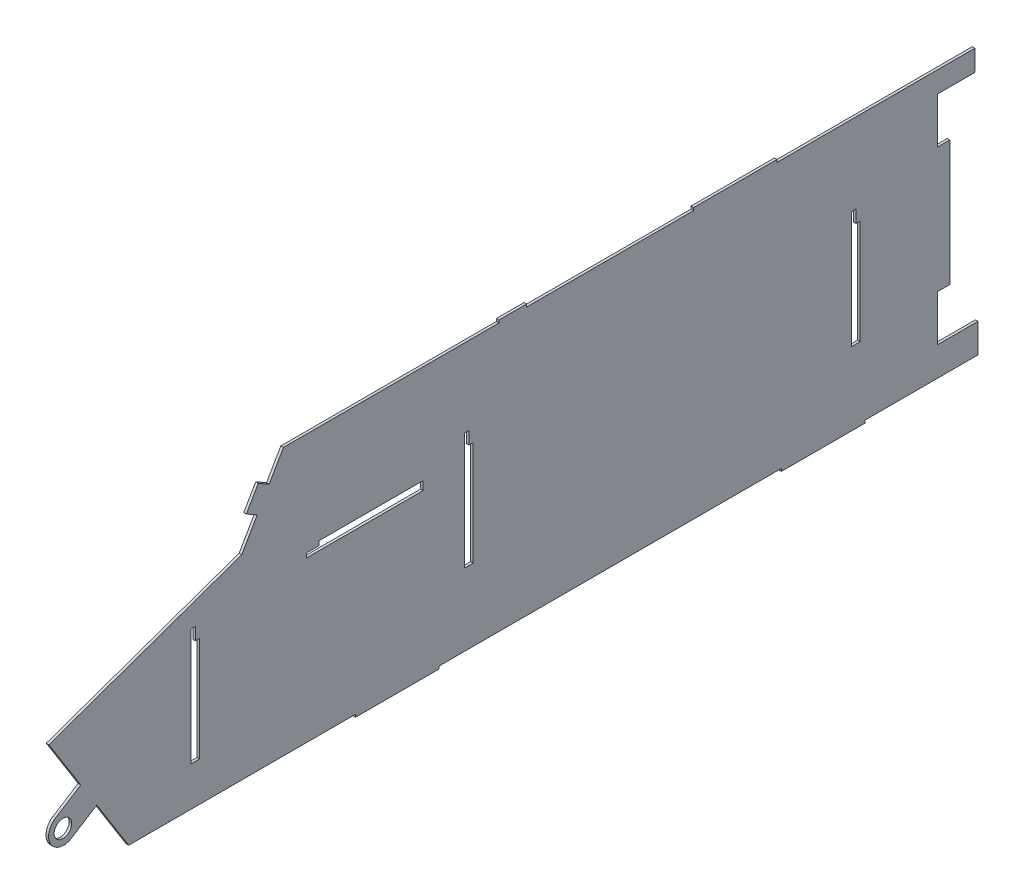
from build123d import *

# Parameters (mm, degrees)
BOSS_EXTRUDE1_DEPTH = 3


with BuildPart() as part:
    # Sketch1 → Boss-Extrude1 (new body)
    with BuildSketch(Plane(origin=(0, 0, 0), x_dir=(0, 0, -1), z_dir=(1, 0, 0))):
        with BuildLine():
            Line((16.10495, 157.49285), (16.10495, 160.49285))
            Line((16.10495, 160.49285), (-15.93645, 160.49285))
            Line((-15.93645, 160.49285), (-15.93645, 157.49285))
            Line((-15.93645, 157.49285), (-265.87855, 157.49285))
            Line((-265.87855, 157.49285), (-282.48125, 128.79465))
            Line((-282.48125, 128.79465), (-295.04705, 136.06965))
            Line((-295.04705, 136.06965), (-308.92005, 112.09525))
            Line((-308.92005, 112.09525), (-296.35425, 104.81525))
            Line((-296.35425, 104.81525), (-314.21085, 73.95765))
            Line((-314.21085, 73.95765), (-537.85245, -5.03885))
            Line((-537.85245, -5.03885), (-500.83535, -63.92765))
            Line((-500.83535, -63.92765), (-529.90705, -82.29115))
            add(Edge.make_bspline(
                [(-529.90705, -82.29115), (-538.09755, -87.38345), (-540.60535, -98.15845), (-535.50965, -106.34895)],
                knots=[0, 0, 0, 0, 1, 1, 1, 1], degree=3))
            add(Edge.make_bspline(
                [(-535.50965, -106.34895), (-530.41395, -114.53935), (-519.64405, -117.04885), (-511.45355, -111.94645)],
                knots=[0, 0, 0, 0, 1, 1, 1, 1], degree=3))
            Line((-511.45355, -111.94645), (-482.27845, -93.44795))
            Line((-482.27845, -93.44795), (-445.30805, -152.26515))
            Line((-445.30805, -152.26515), (-182.28825, -152.26515))
            Line((-182.28825, -152.26515), (-182.28825, -155.26515))
            Line((-182.28825, -155.26515), (-85.48695, -155.26515))
            Line((-85.48695, -155.26515), (-85.48695, -152.26515))
            Line((-85.48695, -152.26515), (311.39965, -152.26515))
            Line((311.39965, -152.26515), (311.39965, -155.26515))
            Line((311.39965, -155.26515), (408.19765, -155.26515))
            Line((408.19765, -155.26515), (408.19765, -152.26515))
            Line((408.19765, -152.26515), (539.35145, -152.26515))
            Line((539.35145, -152.26515), (539.35145, -118.55455))
            Line((539.35145, -118.55455), (492.29645, -118.55455))
            Line((492.29645, -118.55455), (492.29645, -65.31325))
            Line((492.29645, -65.31325), (506.80985, -65.31325))
            Line((506.80985, -65.31325), (506.80985, 79.88545))
            Line((506.80985, 79.88545), (492.28815, 79.88545))
            Line((492.28815, 79.88545), (492.28815, 133.13165))
            Line((492.28815, 133.13165), (535.57645, 133.13165))
            Line((535.57645, 133.13165), (535.76985, 157.49285))
            Line((535.76985, 157.49285), (306.50565, 157.49285))
            Line((306.50565, 157.49285), (306.50565, 160.49285))
            Line((306.50565, 160.49285), (209.70605, 160.49285))
            Line((209.70605, 160.49285), (209.70605, 157.49285))
            Line((209.70605, 157.49285), (16.10495, 157.49285))
        make_face()
        Polygon((-239.31955, 33.14975), (-103.79955, 33.14975), (-103.79955, 43.14975), (-224.79955, 43.14975), (-224.79955, 38.14975), (-239.31955, 38.14975), align=None, mode=Mode.SUBTRACT)
        Polygon((-55.93395, 66.85645), (-55.93395, -68.66355), (-45.93395, -68.66355), (-45.93395, 52.33645), (-50.93395, 52.33645), (-50.93395, 66.85645), align=None, mode=Mode.SUBTRACT)
        Polygon((-372.99945, 28.80995), (-372.99945, -106.71005), (-362.99945, -106.71005), (-362.99945, 14.28995), (-367.99945, 14.28995), (-367.99945, 28.80995), align=None, mode=Mode.SUBTRACT)
        Polygon((392.83665, 64.84155), (392.83665, -70.67845), (402.83665, -70.67845), (402.83665, 50.32155), (397.83665, 50.32155), (397.83665, 64.84155), align=None, mode=Mode.SUBTRACT)
        with BuildLine():
            add(Edge.make_bspline(
                [(-521.52825, -107.45275), (-527.12745, -107.45275), (-531.66795, -102.92065), (-531.66795, -97.31475)],
                knots=[0, 0, 0, 0, 0.333333333, 0.333333333, 0.333333333, 0.333333333], degree=3))
            add(Edge.make_bspline(
                [(-531.66795, -97.31475), (-531.66795, -91.71715), (-527.12915, -87.17505), (-521.52825, -87.17505)],
                knots=[0.333333333, 0.333333333, 0.333333333, 0.333333333, 1, 1, 1, 1], degree=3))
            add(Edge.make_bspline(
                [(-521.52825, -87.17505), (-515.92735, -87.17505), (-511.39025, -91.71385), (-511.39025, -97.31475)],
                knots=[0, 0, 0, 0, 0.333333333, 0.333333333, 0.333333333, 0.333333333], degree=3))
            add(Edge.make_bspline(
                [(-511.39025, -97.31475), (-511.39025, -102.92065), (-515.92895, -107.45275), (-521.52825, -107.45275)],
                knots=[0.333333333, 0.333333333, 0.333333333, 0.333333333, 1, 1, 1, 1], degree=3))
        make_face(mode=Mode.SUBTRACT)
    extrude(amount=BOSS_EXTRUDE1_DEPTH)


solid = part.part
